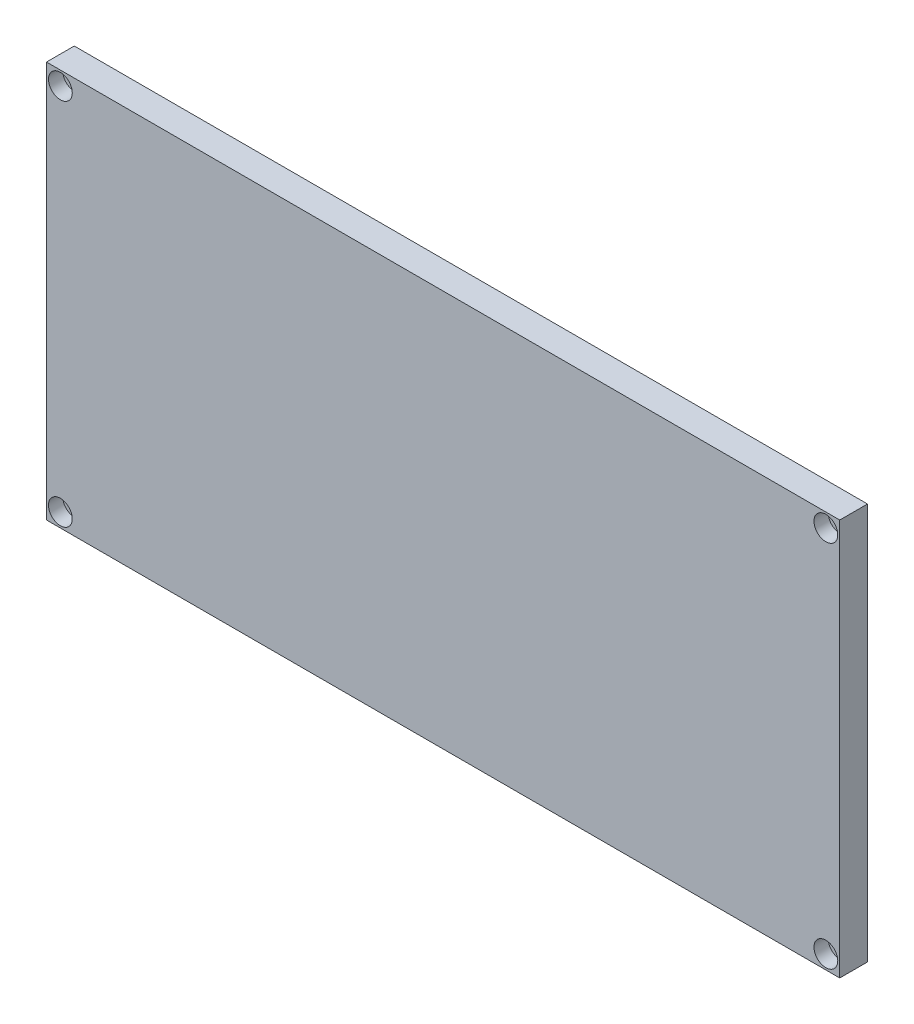
from build123d import *

# Parameters (mm, degrees)
SKETCH1_W           = 50.8
SKETCH1_H           = 25.4
BOSS_EXTRUDE1_DEPTH = 1.778
SKETCH2_R           = 0.762
CUT_EXTRUDE2_DEPTH  = 0.9144


with BuildPart() as part:
    # Sketch1 → Boss-Extrude1 (new body)
    with BuildSketch(Plane.XY):
        Rectangle(SKETCH1_W, SKETCH1_H)
    extrude(amount=-BOSS_EXTRUDE1_DEPTH)

    # Sketch2 → Cut-Extrude2 (cut)
    with BuildSketch(Plane.XY):
        with Locations((-24.511, 11.811)):
            Circle(SKETCH2_R)
        with Locations(Location((24.511, 11.811, 0), (0, 0, 180))):
            Circle(SKETCH2_R)
        with Locations((24.511, -11.811)):
            Circle(SKETCH2_R)
        with Locations(Location((-24.511, -11.811, 0), (0, 0, 180))):
            Circle(SKETCH2_R)
    extrude(amount=-CUT_EXTRUDE2_DEPTH, mode=Mode.SUBTRACT)


solid = part.part
